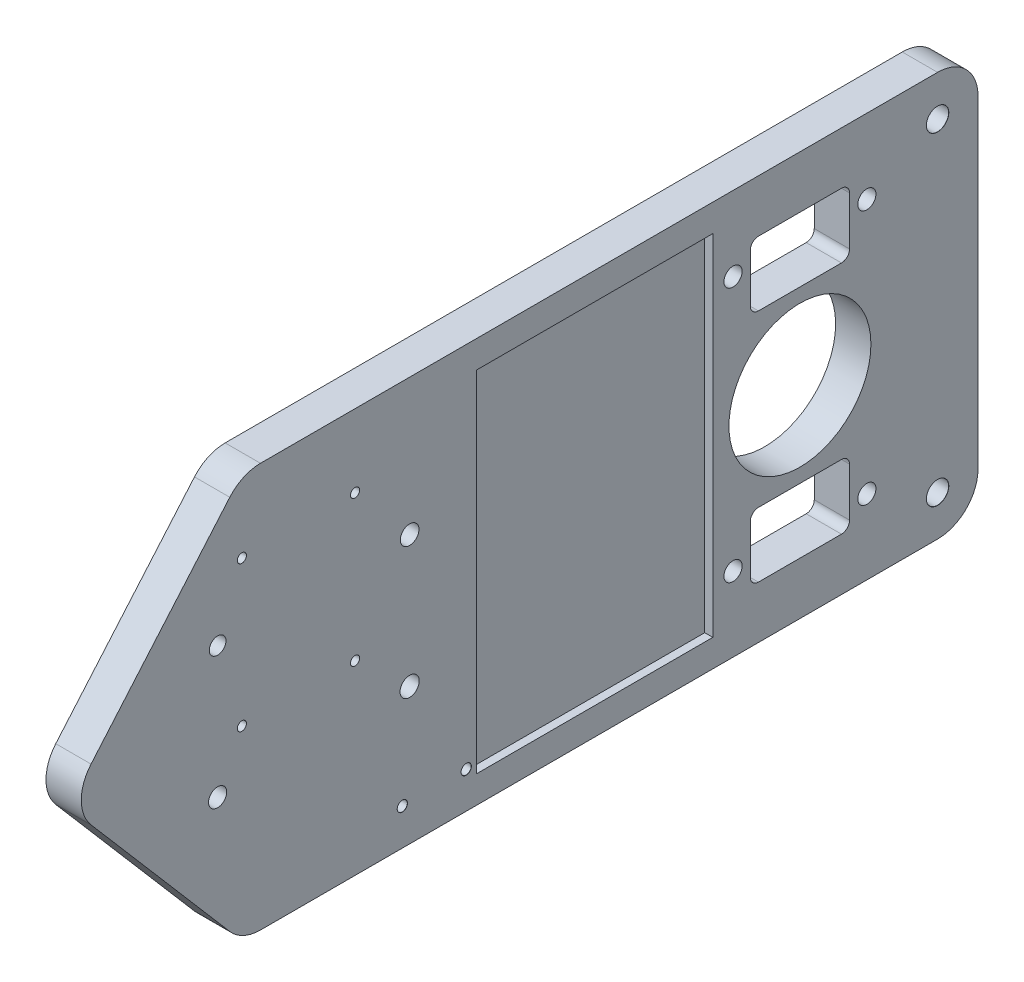
from build123d import *

# Parameters (mm, degrees)
SKETCH1_R                            = 17.5641
BOSS_EXTRUDE1_DEPTH                  = 4.365625
SKETCH2_W                            = 78.1
SKETCH2_H                            = 43.1
BOSS_EXTRUDE2_DEPTH                  = 8.73125
M4_CLEARANCE_HOLE2_AT_2_COUNT        = 2
M4_CLEARANCE_HOLE2_AT_2_PITCH        = 33.1
M4_CLEARANCE_HOLE2_AT_3_COUNT        = 2
M4_CLEARANCE_HOLE2_AT_3_PITCH        = 71.254613886
M4_CLEARANCE_HOLE2_AT_4_COUNT        = 2
M4_CLEARANCE_HOLE2_AT_4_PITCH        = 63.1
SKETCH24_W                           = 78.1
SKETCH24_H                           = 43.1
BOSS_EXTRUDE3_DEPTH                  = 8.73125
TAP_DRILL_FOR_M4X0_7_TAP1_AT_2_COUNT = 2
TAP_DRILL_FOR_M4X0_7_TAP1_AT_2_PITCH = 33.1
TAP_DRILL_FOR_M4X0_7_TAP1_AT_3_COUNT = 2
TAP_DRILL_FOR_M4X0_7_TAP1_AT_3_PITCH = 71.254613886
TAP_DRILL_FOR_M4X0_7_TAP1_AT_4_COUNT = 2
TAP_DRILL_FOR_M4X0_7_TAP1_AT_4_PITCH = 63.1
TAP_DRILL_FOR_M3X0_5_TAP1_AT_2_COUNT = 2
TAP_DRILL_FOR_M3X0_5_TAP1_AT_2_PITCH = 15.8
SKETCH3_R                            = 17.5641
CUT_EXTRUDE3_DEPTH                   = 190.54950551
M5_CLEARANCE_HOLE1_AT_2_COUNT        = 2
M5_CLEARANCE_HOLE1_AT_2_PITCH        = 80
SKETCH14_W                           = 86.5
SKETCH14_H                           = 58.5
CUT_EXTRUDE4_DEPTH                   = 2
FILLET4_R                            = 10
FILLET5_R                            = 5
FILLET6_R                            = 5
SKETCH28_W                           = 15.5
SKETCH28_H                           = 20.75
SKETCH28_R                           = 1.5
BOSS_EXTRUDE4_DEPTH                  = 2.5
FILLET7_R                            = 1
SKETCH29_R                           = 1.5
BOSS_EXTRUDE5_DEPTH                  = 1.5
FILLET8_R                            = 0.5
SKETCH34_W                           = 1.1303
SKETCH34_H                           = 17.4625
TAP_DRILL_FOR_4_40_TAP1_AT_2_COUNT   = 2
TAP_DRILL_FOR_4_40_TAP1_AT_2_PITCH   = 28
TAP_DRILL_FOR_4_40_TAP1_AT_3_COUNT   = 2
TAP_DRILL_FOR_4_40_TAP1_AT_3_PITCH   = 45.607017004
TAP_DRILL_FOR_4_40_TAP1_AT_4_COUNT   = 2
TAP_DRILL_FOR_4_40_TAP1_AT_4_PITCH   = 36
SKETCH35_R                           = 2.25
SKETCH35_R_2                         = 2.064953437
SKETCH35_R_3                         = 2.37369371
SKETCH35_R_4                         = 2.309555233
CUT_EXTRUDE5_DEPTH                   = 187.620222532
SKETCH36_W                           = 16
SKETCH36_H                           = 24.55
CUT_EXTRUDE6_DEPTH                   = 188.638698276
FILLET9_R                            = 2
FILLET10_R                           = 2
FILLET11_R                           = 2


with BuildPart() as part:
    # Sketch1 → Boss-Extrude1 (new, symmetric)
    with BuildSketch(Plane.YZ):
        Polygon((-50, 138.05), (-50, -44.05), (50, -44.05), (50, 138.05), (0, 180.95), align=None)
        with Locations(Location((0, 0, 0), (0, 0, 270))):
            Circle(SKETCH1_R, mode=Mode.SUBTRACT)
    extrude(amount=BOSS_EXTRUDE1_DEPTH, both=True)


with BuildPart() as body_2:
    # Sketch2 → Boss-Extrude2 (new body)
    with BuildSketch(Plane.YZ.offset(4.365625)):
        Rectangle(SKETCH2_W, SKETCH2_H)
    extrude(amount=BOSS_EXTRUDE2_DEPTH)


with BuildPart() as m4_clearance_hole2_tool:
    # Sketch23 → M4 Clearance Hole2 (revolve)
    with BuildSketch(Plane(origin=(13.096875, -31.55, 16.55), x_dir=(0, 0, -1), z_dir=(0, 1, 0))):
        Polygon((0, 0), (0, 17.4625), (2.25, 17.4625), (2.25, 0.025), (2.275, 0), align=None)
    m4_clearance_hole2 = revolve(axis=Axis((19.446875, -31.55, 16.55), (-1, 0, 0)))


with BuildPart() as part_1:
    add(part.part)

    # M4 Clearance Hole2: cut by m4_clearance_hole2_tool
    add(m4_clearance_hole2_tool.part, mode=Mode.SUBTRACT)


with BuildPart() as body_2_1:
    add(body_2.part)

    # M4 Clearance Hole2: cut by m4_clearance_hole2_tool
    add(m4_clearance_hole2_tool.part, mode=Mode.SUBTRACT)


with BuildPart() as m4_clearance_hole2_at_2_tool:
    # M4 Clearance Hole2 at 2: M4 Clearance Hole2 ×2
    with Locations(*[(0, 0, -i * M4_CLEARANCE_HOLE2_AT_2_PITCH) for i in range(1, M4_CLEARANCE_HOLE2_AT_2_COUNT)]):
        add(m4_clearance_hole2)


with BuildPart() as part_2:
    add(part_1.part)

    # M4 Clearance Hole2 at 2: cut by m4_clearance_hole2_at_2_tool
    add(m4_clearance_hole2_at_2_tool.part, mode=Mode.SUBTRACT)


with BuildPart() as body_2_2:
    add(body_2_1.part)

    # M4 Clearance Hole2 at 2: cut by m4_clearance_hole2_at_2_tool
    add(m4_clearance_hole2_at_2_tool.part, mode=Mode.SUBTRACT)


with BuildPart() as m4_clearance_hole2_at_3_tool:
    # M4 Clearance Hole2 at 3: M4 Clearance Hole2 ×2
    with Locations(*[Vector(0, 0.8855566897214588, -0.4645313221835228) * (i * M4_CLEARANCE_HOLE2_AT_3_PITCH) for i in range(1, M4_CLEARANCE_HOLE2_AT_3_COUNT)]):
        add(m4_clearance_hole2)


with BuildPart() as part_3:
    add(part_2.part)

    # M4 Clearance Hole2 at 3: cut by m4_clearance_hole2_at_3_tool
    add(m4_clearance_hole2_at_3_tool.part, mode=Mode.SUBTRACT)


with BuildPart() as body_2_3:
    add(body_2_2.part)

    # M4 Clearance Hole2 at 3: cut by m4_clearance_hole2_at_3_tool
    add(m4_clearance_hole2_at_3_tool.part, mode=Mode.SUBTRACT)


with BuildPart() as m4_clearance_hole2_at_4_tool:
    # M4 Clearance Hole2 at 4: M4 Clearance Hole2 ×2
    with Locations(*[(0, i * M4_CLEARANCE_HOLE2_AT_4_PITCH, 0) for i in range(1, M4_CLEARANCE_HOLE2_AT_4_COUNT)]):
        add(m4_clearance_hole2)


with BuildPart() as part_4:
    add(part_3.part)

    # M4 Clearance Hole2 at 4: cut by m4_clearance_hole2_at_4_tool
    add(m4_clearance_hole2_at_4_tool.part, mode=Mode.SUBTRACT)

    # Sketch10 → Tap Drill for M3x0.5 Tap1 (revolve, cut)
    with BuildSketch(Plane(origin=(4.365625, -41, 98.35), x_dir=(0, 0, -1), z_dir=(0, 1, 0))):
        Polygon((0, 0), (0, 17.4625), (1.25, 17.4625), (1.25, 0.025), (1.275, 0), align=None)
    tap_drill_for_m3x0_5_tap1 = revolve(axis=Axis((10.715625, -41, 98.35), (-1, 0, 0)), mode=Mode.SUBTRACT)

    # Tap Drill for M3x0.5 Tap1 at 2: Tap Drill for M3x0.5 Tap1 ×2
    with Locations(*[(0, 0, -i * TAP_DRILL_FOR_M3X0_5_TAP1_AT_2_PITCH) for i in range(1, TAP_DRILL_FOR_M3X0_5_TAP1_AT_2_COUNT)]):
        add(tap_drill_for_m3x0_5_tap1, mode=Mode.SUBTRACT)

    # Sketch12 → M5 Clearance Hole1 (revolve, cut)
    with BuildSketch(Plane(origin=(4.365625, -40, -34.05), x_dir=(0, 0, -1), z_dir=(0, 1, 0))):
        Polygon((0, 0), (0, 17.4625), (2.75, 17.4625), (2.75, 0.025), (2.775, 0), align=None)
    m5_clearance_hole1 = revolve(axis=Axis((10.715625, -40, -34.05), (-1, 0, 0)), mode=Mode.SUBTRACT)

    # M5 Clearance Hole1 at 2: M5 Clearance Hole1 ×2
    with Locations(*[(0, i * M5_CLEARANCE_HOLE1_AT_2_PITCH, 0) for i in range(1, M5_CLEARANCE_HOLE1_AT_2_COUNT)]):
        add(m5_clearance_hole1, mode=Mode.SUBTRACT)

    # Sketch14 → Cut-Extrude4 (cut)
    with BuildSketch(Plane.YZ.offset(4.365625)):
        with Locations((0, 50.8)):
            Rectangle(SKETCH14_W, SKETCH14_H)
    extrude(amount=-CUT_EXTRUDE4_DEPTH, mode=Mode.SUBTRACT)

    # Fillet4
    fillet4_edges = [part_4.edges().sort_by_distance(p)[0] for p in [
        (0, -50, 138.05),
        (0, 0, 180.95),
        (0, 50, 138.05),
        (0, 50, -44.05),
        (0, -50, -44.05),
    ]]
    fillet(fillet4_edges, radius=FILLET4_R)

    # Sketch34 → Tap Drill for #4-40 Tap1 (revolve, cut)
    with BuildSketch(Plane(origin=(4.365625, -4, 138.05), x_dir=(0, 0, -1), z_dir=(0, 1, 0))):
        with Locations((0.56515, 8.73125)):
            Rectangle(SKETCH34_W, SKETCH34_H)
    tap_drill_for_4_40_tap1 = revolve(axis=Axis((10.715625, -4, 138.05), (-1, 0, 0)), mode=Mode.SUBTRACT)

    # Tap Drill for #4-40 Tap1 at 2: Tap Drill for #4-40 Tap1 ×2
    with Locations(*[(0, 0, -i * TAP_DRILL_FOR_4_40_TAP1_AT_2_PITCH) for i in range(1, TAP_DRILL_FOR_4_40_TAP1_AT_2_COUNT)]):
        add(tap_drill_for_4_40_tap1, mode=Mode.SUBTRACT)

    # Tap Drill for #4-40 Tap1 at 3: Tap Drill for #4-40 Tap1 ×2
    with Locations(*[Vector(0, 0.789352217376326, -0.6139406135149208) * (i * TAP_DRILL_FOR_4_40_TAP1_AT_3_PITCH) for i in range(1, TAP_DRILL_FOR_4_40_TAP1_AT_3_COUNT)]):
        add(tap_drill_for_4_40_tap1, mode=Mode.SUBTRACT)

    # Tap Drill for #4-40 Tap1 at 4: Tap Drill for #4-40 Tap1 ×2
    with Locations(*[(0, i * TAP_DRILL_FOR_4_40_TAP1_AT_4_PITCH, 0) for i in range(1, TAP_DRILL_FOR_4_40_TAP1_AT_4_COUNT)]):
        add(tap_drill_for_4_40_tap1, mode=Mode.SUBTRACT)

    # Sketch35 → Cut-Extrude5 (cut, through all)
    with BuildSketch(Plane.YZ.offset(4.365625)):
        with Locations(Location((-16.25, 144.05, 0), (0, 0, 270))):
            Circle(SKETCH35_R)
        with Locations(Location((16.25, 144.05, 0), (0, 0, 270))):
            Circle(SKETCH35_R_2)
        with Locations(Location((-16.25, 96.55, 0), (0, 0, 270))):
            Circle(SKETCH35_R_3)
        with Locations(Location((16.25, 96.55, 0), (0, 0, 270))):
            Circle(SKETCH35_R_4)
    extrude(amount=-CUT_EXTRUDE5_DEPTH, mode=Mode.SUBTRACT)


with BuildPart() as body_2_4:
    add(body_2_3.part)

    # M4 Clearance Hole2 at 4: cut by m4_clearance_hole2_at_4_tool
    add(m4_clearance_hole2_at_4_tool.part, mode=Mode.SUBTRACT)


with BuildPart() as body_3:
    # Sketch24 → Boss-Extrude3 (new body)
    with BuildSketch(Plane(origin=(-4.365625, 0, 0), x_dir=(0, -1, 0), z_dir=(-1, 0, 0))):
        Rectangle(SKETCH24_W, SKETCH24_H)
    extrude(amount=BOSS_EXTRUDE3_DEPTH)

    # Sketch27 → Tap Drill for M4x0.7 Tap1 (revolve, cut)
    with BuildSketch(Plane(origin=(-13.096875, 31.55, 16.55), x_dir=(0, 0, 1), z_dir=(0, 1, 0))):
        Polygon((0, 0), (0, 9.722670021), (1.65, 8.73125), (1.65, 0.025), (1.675, 0), align=None)
    tap_drill_for_m4x0_7_tap1 = revolve(axis=Axis((-19.446875, 31.55, 16.55), (1, 0, 0)), mode=Mode.SUBTRACT)

    # Tap Drill for M4x0.7 Tap1 at 2: Tap Drill for M4x0.7 Tap1 ×2
    with Locations(*[(0, 0, -i * TAP_DRILL_FOR_M4X0_7_TAP1_AT_2_PITCH) for i in range(1, TAP_DRILL_FOR_M4X0_7_TAP1_AT_2_COUNT)]):
        add(tap_drill_for_m4x0_7_tap1, mode=Mode.SUBTRACT)

    # Tap Drill for M4x0.7 Tap1 at 3: Tap Drill for M4x0.7 Tap1 ×2
    with Locations(*[Vector(0, -0.8855566897214588, -0.4645313221835228) * (i * TAP_DRILL_FOR_M4X0_7_TAP1_AT_3_PITCH) for i in range(1, TAP_DRILL_FOR_M4X0_7_TAP1_AT_3_COUNT)]):
        add(tap_drill_for_m4x0_7_tap1, mode=Mode.SUBTRACT)

    # Tap Drill for M4x0.7 Tap1 at 4: Tap Drill for M4x0.7 Tap1 ×2
    with Locations(*[(0, -i * TAP_DRILL_FOR_M4X0_7_TAP1_AT_4_PITCH, 0) for i in range(1, TAP_DRILL_FOR_M4X0_7_TAP1_AT_4_COUNT)]):
        add(tap_drill_for_m4x0_7_tap1, mode=Mode.SUBTRACT)


with BuildPart() as cut_extrude3_tool:
    # Sketch3 → Cut-Extrude3 (new, through all)
    with BuildSketch(Plane.YZ.offset(13.096875)):
        with Locations(Location((0, 0, 0), (0, 0, 270))):
            Circle(SKETCH3_R)
    extrude(amount=-CUT_EXTRUDE3_DEPTH)


with BuildPart() as body_2_5:
    add(body_2_4.part)

    # Cut-Extrude3: cut by cut_extrude3_tool
    add(cut_extrude3_tool.part, mode=Mode.SUBTRACT)

    # Fillet6
    fillet6_edges = [body_2_5.edges().sort_by_distance(p)[0] for p in [
        (8.73125, -39.05, 21.55),
        (8.73125, 39.05, 21.55),
        (8.73125, 39.05, -21.55),
        (8.73125, -39.05, -21.55),
    ]]
    fillet(fillet6_edges, radius=FILLET6_R)


with BuildPart() as body_3_1:
    add(body_3.part)

    # Cut-Extrude3: cut by cut_extrude3_tool
    add(cut_extrude3_tool.part, mode=Mode.SUBTRACT)

    # Fillet5
    fillet5_edges = [body_3_1.edges().sort_by_distance(p)[0] for p in [
        (-8.73125, -39.05, 21.55),
        (-8.73125, -39.05, -21.55),
        (-8.73125, 39.05, -21.55),
        (-8.73125, 39.05, 21.55),
    ]]
    fillet(fillet5_edges, radius=FILLET5_R)


with BuildPart() as body_4:
    # Sketch28 → Boss-Extrude4 (new body)
    with BuildSketch(Plane.YZ.offset(4.365625)):
        with Locations((-46.275, 90.45)):
            Rectangle(SKETCH28_W, SKETCH28_H)
        with Locations(Location((-41, 82.55, 0), (0, 0, 270))):
            Circle(SKETCH28_R, mode=Mode.SUBTRACT)
        with Locations(Location((-41, 98.35, 0), (0, 0, 270))):
            Circle(SKETCH28_R, mode=Mode.SUBTRACT)
    extrude(amount=BOSS_EXTRUDE4_DEPTH)

    # Fillet7
    fillet7_edges = [body_4.edges().sort_by_distance(p)[0] for p in [
        (5.615625, -38.525, 80.075),
        (5.615625, -54.025, 80.075),
        (5.615625, -54.025, 100.825),
        (5.615625, -38.525, 100.825),
    ]]
    fillet(fillet7_edges, radius=FILLET7_R)

    # Sketch29 → Boss-Extrude5 (add)
    with BuildSketch(Plane(origin=(4.365625, 0, 0), x_dir=(0, -1, 0), z_dir=(-1, 0, 0))):
        with Locations(Location((52.025, 99.2, 0), (0, 0, 90))):
            Circle(SKETCH29_R)
        with Locations(Location((52.025, 95.7, 0), (0, 0, 90))):
            Circle(SKETCH29_R)
        with Locations(Location((52.025, 92.2, 0), (0, 0, 90))):
            Circle(SKETCH29_R)
        with Locations(Location((52.025, 88.7, 0), (0, 0, 90))):
            Circle(SKETCH29_R)
        with Locations(Location((52.025, 85.2, 0), (0, 0, 90))):
            Circle(SKETCH29_R)
        with Locations(Location((52.025, 81.7, 0), (0, 0, 90))):
            Circle(SKETCH29_R)
    extrude(amount=BOSS_EXTRUDE5_DEPTH)

    # Fillet8
    fillet8_edges = [body_4.edges().sort_by_distance(p)[0] for p in [
        (2.865625, -52.025, 97.7),
        (2.865625, -52.025, 94.2),
        (2.865625, -52.025, 90.7),
        (2.865625, -52.025, 87.2),
        (2.865625, -52.025, 83.7),
        (2.865625, -52.025, 80.2),
    ]]
    fillet(fillet8_edges, radius=FILLET8_R)


with BuildPart() as cut_extrude6_tool:
    # Sketch36 → Cut-Extrude6 (new, through all)
    with BuildSketch(Plane.YZ.offset(13.096875)):
        with Locations((-29.05, 0)):
            Rectangle(SKETCH36_W, SKETCH36_H)
        with Locations((29.05, 0)):
            Rectangle(SKETCH36_W, SKETCH36_H)
    extrude(amount=-CUT_EXTRUDE6_DEPTH)


with BuildPart() as part_5:
    add(part_4.part)

    # Cut-Extrude6: cut by cut_extrude6_tool
    add(cut_extrude6_tool.part, mode=Mode.SUBTRACT)

    # Fillet11
    fillet11_edges = [part_5.edges().sort_by_distance(p)[0] for p in [
        (0, -37.05, -12.275),
        (0, -37.05, 12.275),
        (0, -21.05, 12.275),
        (0, -21.05, -12.275),
        (0, 21.05, 12.275),
        (0, 37.05, 12.275),
        (0, 37.05, -12.275),
        (0, 21.05, -12.275),
    ]]
    fillet(fillet11_edges, radius=FILLET11_R)


with BuildPart() as body_2_6:
    add(body_2_5.part)

    # Cut-Extrude6: cut by cut_extrude6_tool
    add(cut_extrude6_tool.part, mode=Mode.SUBTRACT)

    # Fillet9
    fillet9_edges = [body_2_6.edges().sort_by_distance(p)[0] for p in [
        (8.73125, -37.05, -12.275),
        (8.73125, -37.05, 12.275),
        (8.73125, -21.05, 12.275),
        (8.73125, -21.05, -12.275),
        (8.73125, 21.05, 12.275),
        (8.73125, 37.05, 12.275),
        (8.73125, 37.05, -12.275),
        (8.73125, 21.05, -12.275),
    ]]
    fillet(fillet9_edges, radius=FILLET9_R)


with BuildPart() as body_3_2:
    add(body_3_1.part)

    # Cut-Extrude6: cut by cut_extrude6_tool
    add(cut_extrude6_tool.part, mode=Mode.SUBTRACT)

    # Fillet10
    fillet10_edges = [body_3_2.edges().sort_by_distance(p)[0] for p in [
        (-8.73125, -37.05, -12.275),
        (-8.73125, -37.05, 12.275),
        (-8.73125, -21.05, 12.275),
        (-8.73125, -21.05, -12.275),
        (-8.73125, 21.05, 12.275),
        (-8.73125, 37.05, 12.275),
        (-8.73125, 37.05, -12.275),
        (-8.73125, 21.05, -12.275),
    ]]
    fillet(fillet10_edges, radius=FILLET10_R)


solid = part_5.part
